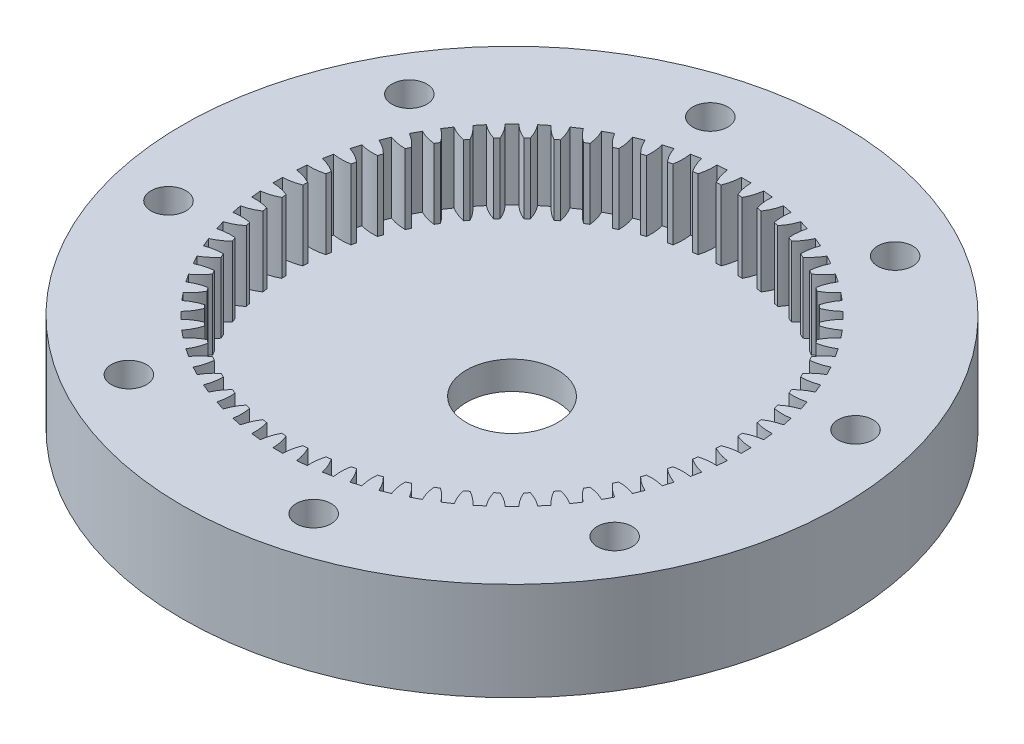
from build123d import *

# Parameters (mm, degrees)
SKETCH1_R               = 16.7
SKETCH1_R_2             = 16
SKETCH1_R_3             = 15.5
BOSS_EXTRUDE1_DEPTH     = 2.5
SKETCH4_R               = 23.5
SKETCH4_R_2             = 15.5
BOSS_EXTRUDE2_DEPTH     = 2.5
CUT_EXTRUDE1_DEPTH      = 34.327916226
CIRPATTERN1_COUNT       = 64
CUT_EXTRUDE2_DEPTH      = 34.327916226
CUT_EXTRUDE2_DEPTH_BACK = 34.327916226
SKETCH5_R               = 15.51826058
SKETCH8_R               = 23.5
SKETCH8_R_2             = 3.25
BOSS_EXTRUDE3_DEPTH     = 2
SKETCH6_R               = 1.25
CUT_EXTRUDE3_DEPTH      = 34.963215395
CIRPATTERN2_COUNT       = 8


with BuildPart() as part:
    # Sketch1 → Boss-Extrude1 (new, symmetric)
    # profile 1 of 3: a face of its own
    with BuildSketch(Plane(origin=(0, 0, 0), x_dir=(1, 0, 0), z_dir=(0, 1, 0))):
        with Locations(Location((0, 0, 0), (0, 0, 270))):
            Circle(SKETCH1_R)
        Circle(SKETCH1_R_2, mode=Mode.SUBTRACT)
    # profile 2 of 3: a face of its own
    with BuildSketch(Plane(origin=(0, 0, 0), x_dir=(1, 0, 0), z_dir=(0, 1, 0))):
        Circle(SKETCH1_R_2)
        Circle(SKETCH1_R_3, mode=Mode.SUBTRACT)
    # profile 3 of 3: a face of its own
    with BuildSketch(Plane(origin=(0, 0, 0), x_dir=(1, 0, 0), z_dir=(0, 1, 0))):
        Circle(SKETCH1_R_3)
    extrude(amount=BOSS_EXTRUDE1_DEPTH, both=True)

    # Sketch4 → Boss-Extrude2 (add, symmetric)
    with BuildSketch(Plane(origin=(0, 0, 0), x_dir=(1, 0, 0), z_dir=(0, 1, 0))):
        with Locations(Location((0, 0, 0), (0, 0, 270))):
            Circle(SKETCH4_R)
        Circle(SKETCH4_R_2, mode=Mode.SUBTRACT)
    extrude(amount=BOSS_EXTRUDE2_DEPTH, both=True)

    # Sketch3 → Cut-Extrude1 (cut, symmetric)
    with BuildSketch(Plane(origin=(0, 0, 0), x_dir=(1, 0, 0), z_dir=(0, 1, 0))):
        with BuildLine():
            ThreePointArc((0.595699541, 15.506822805), (0, 15.496194933), (-0.595699541, 15.506822805))
            ThreePointArc((-0.595699541, 15.506822805), (-0.413859687, 16.091633995), (-0.343427697, 16.7))
            ThreePointArc((-0.343427697, 16.7), (0, 16.696194933), (0.343427697, 16.7))
            ThreePointArc((0.343427697, 16.7), (0.413859687, 16.091633995), (0.595699541, 15.506822805))
        make_face()
    cut_extrude1 = extrude(amount=CUT_EXTRUDE1_DEPTH, both=True, mode=Mode.SUBTRACT)

    # CirPattern1: Cut-Extrude1 ×64 about axis
    cirpattern1_axis = Axis((0, 0, 0), (0, 1, 0))
    for i in range(1, CIRPATTERN1_COUNT):
        add(cut_extrude1.rotate(cirpattern1_axis, i * 360 / CIRPATTERN1_COUNT), mode=Mode.SUBTRACT)

    # Sketch5 → Cut-Extrude2 (cut, two sides: drawn at the far end of the back side and taken through both)
    with BuildSketch(Plane(origin=(0, 0, 0), x_dir=(1, 0, 0), z_dir=(0, 1, 0)).offset(-CUT_EXTRUDE2_DEPTH_BACK)):
        Circle(SKETCH5_R)
    extrude(amount=CUT_EXTRUDE2_DEPTH + CUT_EXTRUDE2_DEPTH_BACK, mode=Mode.SUBTRACT)

    # Sketch8 → Boss-Extrude3 (add)
    with BuildSketch(Plane.XZ.offset(2.5)):
        with Locations(Location((0, 0, 0), (0, 0, 270))):
            Circle(SKETCH8_R)
        with Locations(Location((0, 0, 0), (0, 0, 270))):
            Circle(SKETCH8_R_2, mode=Mode.SUBTRACT)
    extrude(amount=BOSS_EXTRUDE3_DEPTH)

    # Sketch6 → Cut-Extrude3 (cut, through all)
    with BuildSketch(Plane(origin=(0, 2.5, 0), x_dir=(1, 0, 0), z_dir=(0, 1, 0))):
        with Locations(Location((5.176380902, -19.318516526, 0), (0, 0, 270))):
            Circle(SKETCH6_R)
    cut_extrude3 = extrude(amount=-CUT_EXTRUDE3_DEPTH, mode=Mode.SUBTRACT)

    # CirPattern2: Cut-Extrude3 ×8 about axis
    cirpattern2_axis = Axis((0, 0, 0), (0, 1, 0))
    for i in range(1, CIRPATTERN2_COUNT):
        add(cut_extrude3.rotate(cirpattern2_axis, i * 360 / CIRPATTERN2_COUNT), mode=Mode.SUBTRACT)


solid = part.part
